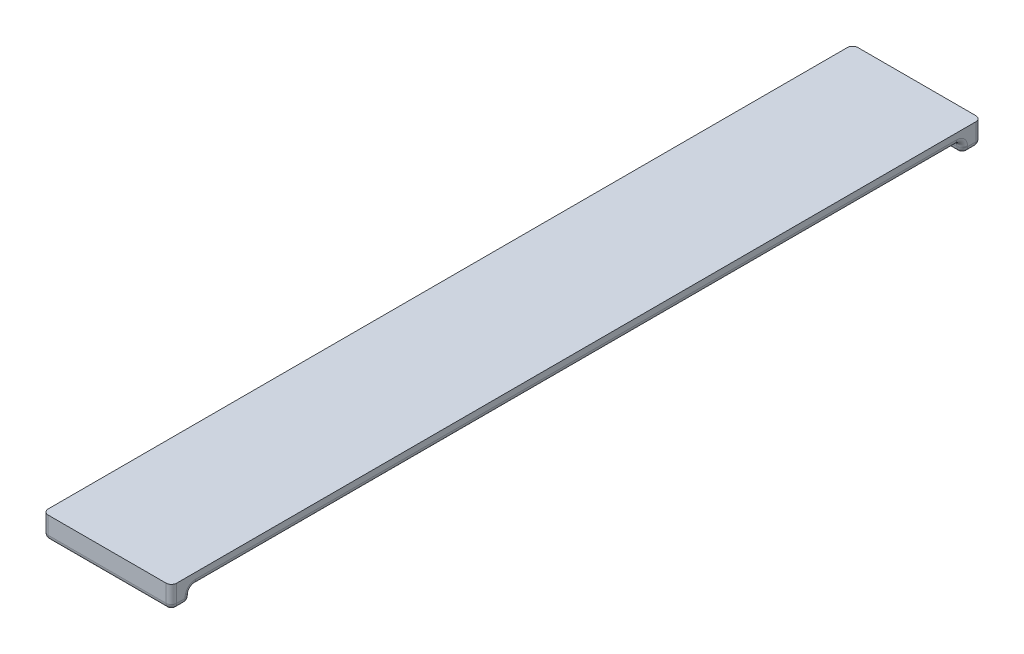
from build123d import *

# Parameters (mm, degrees)
BOSS_EXTRUDE1_DEPTH = 0.75
SKETCH2_W           = 8.459553448
SKETCH2_H           = 1.25
BOSS_EXTRUDE2_DEPTH = 0.75
BOSS_EXTRUDE3_DEPTH = 1.25
LPATTERN1_COUNT     = 10
LPATTERN1_PITCH     = 5.068
FILLET1_R           = 0.35


with BuildPart() as part:
    # Sketch1 → Boss-Extrude1 (new body)
    with BuildSketch(Plane(origin=(0, 0, 0), x_dir=(1, 0, 0), z_dir=(0, 1, 0))):
        Polygon((-17.603069868, -25.4), (-17.603069868, 25.4), (-17.603069868, 26.65), (-9.14351642, 26.65), (-9.14351642, 25.4), (-9.14351642, -25.4), (-9.14351642, -26.65), (-17.603069868, -26.65), align=None)
    extrude(amount=BOSS_EXTRUDE1_DEPTH)

    # Sketch2 → Boss-Extrude2 (add)
    with BuildSketch(Plane.XZ):
        with Locations((-13.373293144, 26.025)):
            Rectangle(SKETCH2_W, SKETCH2_H)
        with Locations((-13.373293144, -26.025)):
            Rectangle(SKETCH2_W, SKETCH2_H)
    extrude(amount=BOSS_EXTRUDE2_DEPTH)

    # Sketch3 → Boss-Extrude3 (add)
    with BuildSketch(Plane.XZ):
        with BuildLine():
            Line((-17.603069868, -24.3), (-12.103069868, -24.3))
            ThreePointArc((-12.103069868, -24.3), (-10.603069868, -22.8), (-12.103069868, -21.3))
            Line((-12.103069868, -21.3), (-17.603069868, -21.3))
            Line((-17.603069868, -21.3), (-17.603069868, -24.3))
        make_face()
    boss_extrude3 = extrude(amount=BOSS_EXTRUDE3_DEPTH)

    # LPattern1: Boss-Extrude3 ×10
    with Locations(*[(0, 0, i * LPATTERN1_PITCH) for i in range(1, LPATTERN1_COUNT)]):
        add(boss_extrude3)

    # Fillet1
    fillet1_edges = [part.edges().sort_by_distance(p)[0] for p in [
        (-14.853069868, -1.25, -4.028),
        (-10.603069868, -1.25, -2.528),
        (-14.853069868, -1.25, -1.028),
        (-17.603069868, 0, 5.074),
        (-17.603069868, -0.625, 4.04),
        (-14.853069868, 0, 1.04),
        (-17.603069868, -0.625, 1.04),
        (-10.603069868, 0, 2.54),
        (-14.853069868, 0, 4.04),
        (-17.603069868, -1.25, 2.54),
        (-14.853069868, -1.25, 1.04),
        (-10.603069868, -1.25, 2.54),
        (-14.853069868, -1.25, 4.04),
        (-17.603069868, 0, 10.142),
        (-17.603069868, -0.625, 9.108),
        (-14.853069868, 0, 6.108),
        (-17.603069868, -0.625, 6.108),
        (-10.603069868, 0, 7.608),
        (-14.853069868, 0, 9.108),
        (-17.603069868, -1.25, 7.608),
        (-14.853069868, -1.25, 6.108),
        (-10.603069868, -1.25, 7.608),
        (-14.853069868, -1.25, 9.108),
        (-17.603069868, 0, 15.21),
        (-17.603069868, -0.625, 14.176),
        (-14.853069868, 0, 11.176),
        (-17.603069868, -0.625, 11.176),
        (-10.603069868, 0, 12.676),
        (-14.853069868, 0, 14.176),
        (-17.603069868, -1.25, 12.676),
        (-14.853069868, -1.25, 11.176),
        (-10.603069868, -1.25, 12.676),
        (-14.853069868, -1.25, 14.176),
        (-17.603069868, 0, 20.278),
        (-17.603069868, -0.625, 19.244),
        (-14.853069868, 0, 16.244),
        (-17.603069868, -0.625, 16.244),
        (-10.603069868, 0, 17.744),
        (-14.853069868, 0, 19.244),
        (-17.603069868, -1.25, 17.744),
        (-14.853069868, -1.25, 16.244),
        (-10.603069868, -1.25, 17.744),
        (-14.853069868, -1.25, 19.244),
        (-17.603069868, 0, -26.65),
        (-9.14351642, 0, -26.65),
        (-9.14351642, 0, 26.65),
        (-17.603069868, 0, 26.65),
        (-17.603069868, 0, 24.856),
        (-17.603069868, -0.625, 24.312),
        (-14.853069868, 0, 21.312),
        (-17.603069868, -0.625, 21.312),
        (-10.603069868, 0, 22.812),
        (-14.853069868, 0, 24.312),
        (-17.603069868, -1.25, 22.812),
        (-14.853069868, -1.25, 21.312),
        (-10.603069868, -1.25, 22.812),
        (-14.853069868, -1.25, 24.312),
        (-9.14351642, 0, 0),
        (-9.14351642, -0.375, 25.4),
        (-13.373293144, 0, 25.4),
        (-17.603069868, -0.375, 25.4),
        (-9.14351642, -0.75, 26.025),
        (-13.373293144, -0.75, 26.65),
        (-17.603069868, -0.75, 26.025),
        (-13.373293144, -0.75, 25.4),
        (-17.603069868, 0, -24.85),
        (-13.373293144, 0, -25.4),
        (-9.14351642, -0.375, -25.4),
        (-17.603069868, -0.375, -25.4),
        (-9.14351642, -0.75, -26.025),
        (-13.373293144, -0.75, -25.4),
        (-17.603069868, -0.75, -26.025),
        (-13.373293144, -0.75, -26.65),
        (-17.603069868, 0, -20.266),
        (-17.603069868, -0.625, -21.3),
        (-14.853069868, 0, -24.3),
        (-17.603069868, -0.625, -24.3),
        (-10.603069868, 0, -22.8),
        (-14.853069868, 0, -21.3),
        (-17.603069868, -1.25, -22.8),
        (-14.853069868, -1.25, -24.3),
        (-10.603069868, -1.25, -22.8),
        (-14.853069868, -1.25, -21.3),
        (-17.603069868, 0, -15.198),
        (-17.603069868, -0.625, -16.232),
        (-14.853069868, 0, -19.232),
        (-17.603069868, -0.625, -19.232),
        (-10.603069868, 0, -17.732),
        (-14.853069868, 0, -16.232),
        (-17.603069868, -1.25, -17.732),
        (-14.853069868, -1.25, -19.232),
        (-10.603069868, -1.25, -17.732),
        (-14.853069868, -1.25, -16.232),
        (-17.603069868, 0, -10.13),
        (-17.603069868, -0.625, -11.164),
        (-14.853069868, 0, -14.164),
        (-17.603069868, -0.625, -14.164),
        (-10.603069868, 0, -12.664),
        (-14.853069868, 0, -11.164),
        (-17.603069868, -1.25, -12.664),
        (-14.853069868, -1.25, -14.164),
        (-10.603069868, -1.25, -12.664),
        (-14.853069868, -1.25, -11.164),
        (-17.603069868, 0, -5.062),
        (-17.603069868, -0.625, -6.096),
        (-14.853069868, 0, -9.096),
        (-17.603069868, -0.625, -9.096),
        (-10.603069868, 0, -7.596),
        (-14.853069868, 0, -6.096),
        (-17.603069868, -1.25, -7.596),
        (-14.853069868, -1.25, -9.096),
        (-10.603069868, -1.25, -7.596),
        (-14.853069868, -1.25, -6.096),
        (-17.603069868, 0, 0.006),
        (-17.603069868, -0.625, -1.028),
        (-14.853069868, 0, -4.028),
        (-17.603069868, -0.625, -4.028),
        (-10.603069868, 0, -2.528),
        (-14.853069868, 0, -1.028),
        (-17.603069868, -1.25, -2.528),
    ]]
    fillet(fillet1_edges, radius=FILLET1_R)


solid = part.part
